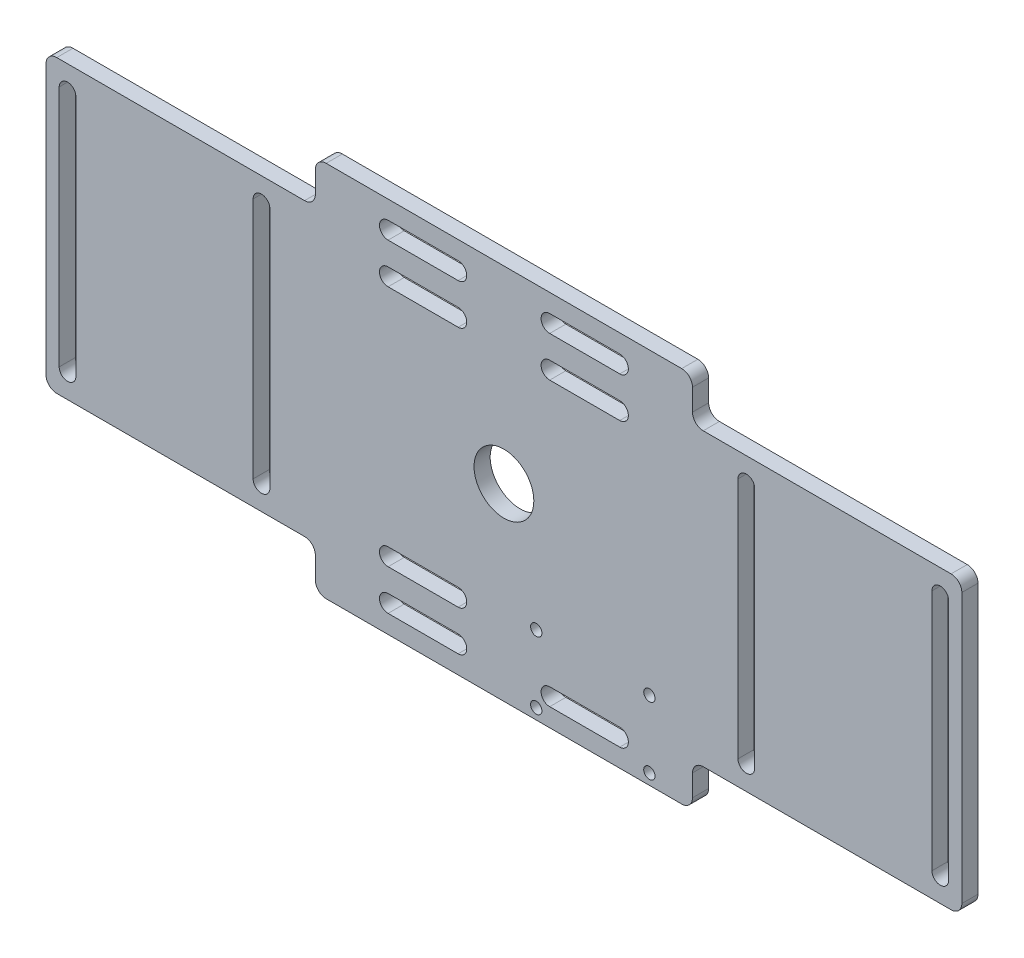
from build123d import *

# Parameters (mm, degrees)
SKETCH_1_W          = 170
SKETCH_1_H          = 70
EXTRUDE_1_DEPTH     = 3
SKETCH_2_R          = 5.55
SKETCH_2_R_2        = 1.05
CUT_EXTRUDE_1_DEPTH = 92.972822073
CUT_EXTRUDE_2_DEPTH = 92.972822073


with BuildPart() as part:
    # 草圖1 → 填料-伸長1 (new body)
    with BuildSketch(Plane.XY):
        Rectangle(SKETCH_1_W, SKETCH_1_H)
    extrude(amount=EXTRUDE_1_DEPTH)

    # 草圖2 → 除料-伸長1 (cut, through all)
    with BuildSketch(Plane.XY.offset(3)):
        Circle(SKETCH_2_R)
        with Locations((27, -20.5)):
            Circle(SKETCH_2_R_2)
        with Locations((6, -20.5)):
            Circle(SKETCH_2_R_2)
        with Locations((6, -33)):
            Circle(SKETCH_2_R_2)
        with Locations((27, -33)):
            Circle(SKETCH_2_R_2)
        with BuildLine():
            Line((43.45, -22.5), (43.45, 22.5))
            ThreePointArc((43.45, 22.5), (45, 24.05), (46.55, 22.5))
            Line((46.55, 22.5), (46.55, -22.5))
            ThreePointArc((46.55, -22.5), (45, -24.05), (43.45, -22.5))
        make_face()
        with BuildLine():
            Line((-46.55, -22.5), (-46.55, 22.5))
            ThreePointArc((-46.55, 22.5), (-45, 24.05), (-43.45, 22.5))
            Line((-43.45, 22.5), (-43.45, -22.5))
            ThreePointArc((-43.45, -22.5), (-45, -24.05), (-46.55, -22.5))
        make_face()
        with BuildLine():
            Line((-82.55, -22.5), (-82.55, 22.5))
            ThreePointArc((-82.55, 22.5), (-81, 24.05), (-79.45, 22.5))
            Line((-79.45, 22.5), (-79.45, -22.5))
            ThreePointArc((-79.45, -22.5), (-81, -24.05), (-82.55, -22.5))
        make_face()
        with BuildLine():
            Line((79.45, -22.5), (79.45, 22.5))
            ThreePointArc((79.45, 22.5), (81, 24.05), (82.55, 22.5))
            Line((82.55, 22.5), (82.55, -22.5))
            ThreePointArc((82.55, -22.5), (81, -24.05), (79.45, -22.5))
        make_face()
        with BuildLine():
            Line((21.5, -31.6), (8.5, -31.6))
            ThreePointArc((8.5, -31.6), (6.9, -30), (8.5, -28.4))
            Line((8.5, -28.4), (21.5, -28.4))
            ThreePointArc((21.5, -28.4), (23.1, -30), (21.5, -31.6))
        make_face()
        with BuildLine():
            Line((-21.5, -31.6), (-8.5, -31.6))
            ThreePointArc((-8.5, -31.6), (-6.9, -30), (-8.5, -28.4))
            Line((-8.5, -28.4), (-21.5, -28.4))
            ThreePointArc((-21.5, -28.4), (-23.1, -30), (-21.5, -31.6))
        make_face()
        with BuildLine():
            Line((21.5, 31.6), (8.5, 31.6))
            ThreePointArc((8.5, 31.6), (6.9, 30), (8.5, 28.4))
            Line((8.5, 28.4), (21.5, 28.4))
            ThreePointArc((21.5, 28.4), (23.1, 30), (21.5, 31.6))
        make_face()
        with BuildLine():
            Line((-21.5, 31.6), (-8.5, 31.6))
            ThreePointArc((-8.5, 31.6), (-6.9, 30), (-8.5, 28.4))
            Line((-8.5, 28.4), (-21.5, 28.4))
            ThreePointArc((-21.5, 28.4), (-23.1, 30), (-21.5, 31.6))
        make_face()
        with BuildLine():
            Line((21.5, 24.1), (8.5, 24.1))
            ThreePointArc((8.5, 24.1), (6.9, 22.5), (8.5, 20.9))
            Line((8.5, 20.9), (21.5, 20.9))
            ThreePointArc((21.5, 20.9), (23.1, 22.5), (21.5, 24.1))
        make_face()
        with BuildLine():
            Line((-21.5, 24.1), (-8.5, 24.1))
            ThreePointArc((-8.5, 24.1), (-6.9, 22.5), (-8.5, 20.9))
            Line((-8.5, 20.9), (-21.5, 20.9))
            ThreePointArc((-21.5, 20.9), (-23.1, 22.5), (-21.5, 24.1))
        make_face()
        with BuildLine():
            Line((-21.5, -24.1), (-8.5, -24.1))
            ThreePointArc((-8.5, -24.1), (-6.9, -22.5), (-8.5, -20.9))
            Line((-8.5, -20.9), (-21.5, -20.9))
            ThreePointArc((-21.5, -20.9), (-23.1, -22.5), (-21.5, -24.1))
        make_face()
    extrude(amount=-CUT_EXTRUDE_1_DEPTH, mode=Mode.SUBTRACT)

    # 草圖4 → 除料-伸長2 (cut, through all)
    with BuildSketch(Plane.XY.offset(3)):
        with BuildLine():
            Line((85, 35), (35, 35))
            Line((35, 35), (33, 35))
            ThreePointArc((33, 35), (34.414213562, 34.414213562), (35, 33))
            Line((35, 33), (35, 29))
            ThreePointArc((35, 29), (35.585786438, 27.585786438), (37, 27))
            Line((37, 27), (83, 27))
            ThreePointArc((83, 27), (84.414213562, 26.414213562), (85, 25))
            Line((85, 25), (85, 27))
            Line((85, 27), (85, 35))
        make_face()
        with BuildLine():
            Line((85, -27), (85, -25))
            ThreePointArc((85, -25), (84.414213562, -26.414213562), (83, -27))
            Line((83, -27), (37, -27))
            ThreePointArc((37, -27), (35.585786438, -27.585786438), (35, -29))
            Line((35, -29), (35, -33))
            ThreePointArc((35, -33), (34.414213562, -34.414213562), (33, -35))
            Line((33, -35), (35, -35))
            Line((35, -35), (85, -35))
            Line((85, -35), (85, -27))
        make_face()
        with BuildLine():
            Line((-85, -35), (-35, -35))
            Line((-35, -35), (-33, -35))
            ThreePointArc((-33, -35), (-34.414213562, -34.414213562), (-35, -33))
            Line((-35, -33), (-35, -29))
            ThreePointArc((-35, -29), (-35.585786438, -27.585786438), (-37, -27))
            Line((-37, -27), (-83, -27))
            ThreePointArc((-83, -27), (-84.414213562, -26.414213562), (-85, -25))
            Line((-85, -25), (-85, -27))
            Line((-85, -27), (-85, -35))
        make_face()
        with BuildLine():
            Line((-85, 27), (-85, 25))
            ThreePointArc((-85, 25), (-84.414213562, 26.414213562), (-83, 27))
            Line((-83, 27), (-37, 27))
            ThreePointArc((-37, 27), (-35.585786438, 27.585786438), (-35, 29))
            Line((-35, 29), (-35, 33))
            ThreePointArc((-35, 33), (-34.414213562, 34.414213562), (-33, 35))
            Line((-33, 35), (-35, 35))
            Line((-35, 35), (-85, 35))
            Line((-85, 35), (-85, 27))
        make_face()
    extrude(amount=-CUT_EXTRUDE_2_DEPTH, mode=Mode.SUBTRACT)


solid = part.part
